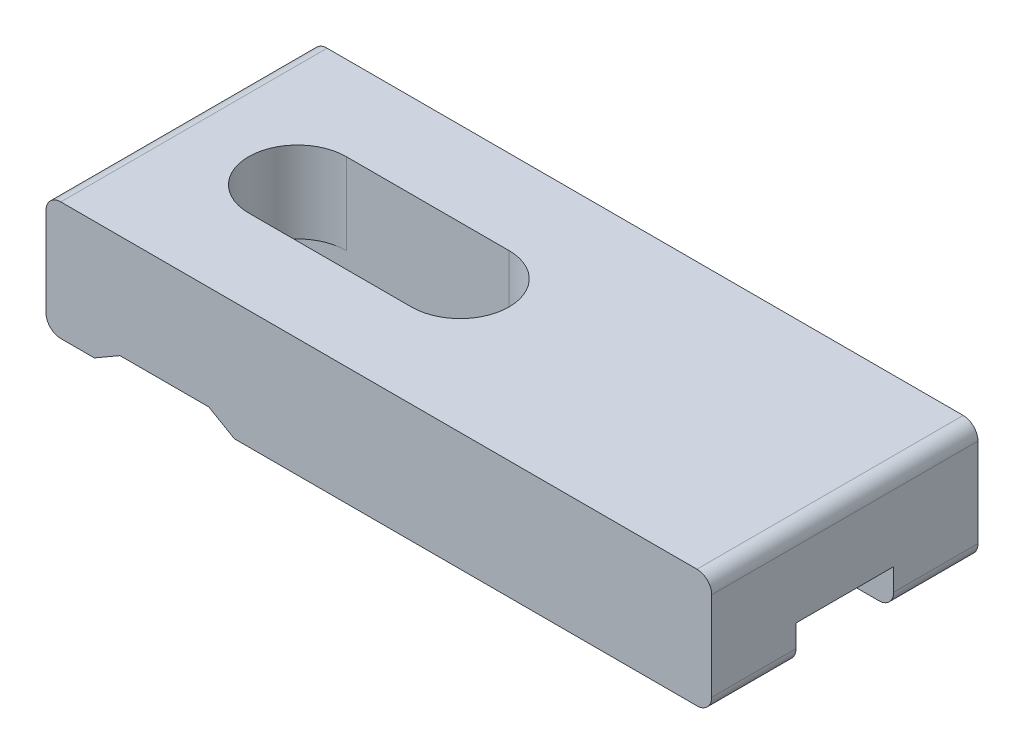
from build123d import *

# Parameters (mm, degrees)
SKETCH_1_W          = 45
SKETCH_1_H          = 8
EXTRUDE_1_DEPTH     = 9
CUT_EXTRUDE_1_DEPTH = 26.51960031
SKETCH_4_W          = 6.6
SKETCH_4_H          = 2.5
CUT_EXTRUDE_2_DEPTH = 47.583258795
CUT_EXTRUDE_3_DEPTH = 30.904013109
FILLET_1_R          = 1
SCALE_1_SCALE       = 2.666666667


with BuildPart() as part:
    # 草图1 → 凸台-拉伸1 (new, symmetric)
    with BuildSketch(Plane.XY):
        with Locations((0, 4)):
            Rectangle(SKETCH_1_W, SKETCH_1_H)
    extrude(amount=EXTRUDE_1_DEPTH, both=True)

    # 草图2 → 切除-拉伸1 (cut, through all)
    with BuildSketch(Plane(origin=(0, 8, 0), x_dir=(1, 0, 0), z_dir=(0, 1, 0))):
        with BuildLine():
            Line((-14.5, 3.3), (-3.5, 3.3))
            ThreePointArc((-3.5, 3.3), (-0.2, 0), (-3.5, -3.3))
            Line((-3.5, -3.3), (-14.5, -3.3))
            ThreePointArc((-14.5, -3.3), (-17.8, 0), (-14.5, 3.3))
        make_face()
    extrude(amount=-CUT_EXTRUDE_1_DEPTH, mode=Mode.SUBTRACT)

    # 草图4 → 切除-拉伸2 (cut, through all)
    with BuildSketch(Plane(origin=(22.5, 0, 0), x_dir=(0, 0, -1), z_dir=(1, 0, 0))):
        with Locations((0, 1.25)):
            Rectangle(SKETCH_4_W, SKETCH_4_H)
    extrude(amount=-CUT_EXTRUDE_2_DEPTH, mode=Mode.SUBTRACT)

    # 草图5 → 切除-拉伸3 (cut, through all)
    with BuildSketch(Plane.XY.offset(9)):
        Polygon((-17.5, 1), (-11.5, 1), (-9.767949192, 0), (-19.232050808, 0), align=None)
    extrude(amount=-CUT_EXTRUDE_3_DEPTH, mode=Mode.SUBTRACT)

    # 圆角1
    fillet_1_edges = [part.edges().sort_by_distance(p)[0] for p in [
        (22.5, 0, -6.15),
        (-22.5, 0, -6.15),
        (-22.5, 8, 0),
        (22.5, 8, 0),
        (22.5, 0, 6.15),
        (-22.5, 0, 6.15),
    ]]
    fillet(fillet_1_edges, radius=FILLET_1_R)


with BuildPart() as part_1:
    # 缩放比例1: scaled about (1.300247122, 4.318589473, 0)
    add(part.part.scale(SCALE_1_SCALE).moved(Location((-2.167078537, -7.197649122, 0))))


solid = part_1.part
